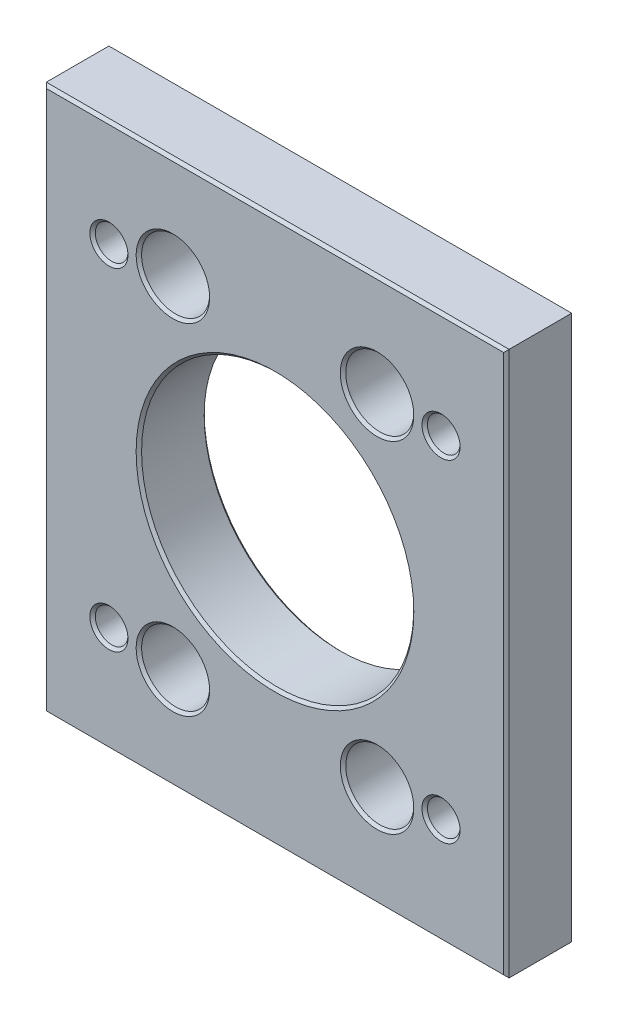
from build123d import *

# Parameters (mm, degrees)
SKETCH1_W           = 43.18
SKETCH1_H           = 50.8
SKETCH1_R           = 1.524
SKETCH1_R_2         = 3.175
SKETCH1_R_3         = 12.7
BOSS_EXTRUDE1_DEPTH = 6.35
CHAMFER1_SIZE       = 0.254


with BuildPart() as part:
    # Sketch1 → Boss-Extrude1 (new body)
    with BuildSketch(Plane.XY):
        Rectangle(SKETCH1_W, SKETCH1_H)
        with Locations((-15.494, 15.494)):
            Circle(SKETCH1_R, mode=Mode.SUBTRACT)
        with Locations((-9.525, 15.875)):
            Circle(SKETCH1_R_2, mode=Mode.SUBTRACT)
        with Locations((-15.494, -15.494)):
            Circle(SKETCH1_R, mode=Mode.SUBTRACT)
        with Locations((-9.525, -15.875)):
            Circle(SKETCH1_R_2, mode=Mode.SUBTRACT)
        with Locations((9.525, -15.875)):
            Circle(SKETCH1_R_2, mode=Mode.SUBTRACT)
        with Locations((15.494, -15.494)):
            Circle(SKETCH1_R, mode=Mode.SUBTRACT)
        with Locations((9.525, 15.875)):
            Circle(SKETCH1_R_2, mode=Mode.SUBTRACT)
        with Locations((15.494, 15.494)):
            Circle(SKETCH1_R, mode=Mode.SUBTRACT)
        Circle(SKETCH1_R_3, mode=Mode.SUBTRACT)
    extrude(amount=BOSS_EXTRUDE1_DEPTH)

    # Chamfer1
    chamfer1_edges = [part.edges().sort_by_distance(p)[0] for p in [
        (-21.59, 0, 6.35),
        (-17.018, 15.494, 0),
        (-17.018, 15.494, 6.35),
        (0, -25.4, 6.35),
        (-12.7, 15.875, 0),
        (-12.7, 15.875, 6.35),
        (-17.018, -15.494, 0),
        (-17.018, -15.494, 6.35),
        (-12.7, -15.875, 0),
        (-12.7, -15.875, 6.35),
        (6.35, -15.875, 0),
        (6.35, -15.875, 6.35),
        (13.97, -15.494, 0),
        (13.97, -15.494, 6.35),
        (6.35, 15.875, 0),
        (6.35, 15.875, 6.35),
        (13.97, 15.494, 0),
        (13.97, 15.494, 6.35),
        (21.59, 0, 6.35),
        (-12.7, 0, 0),
        (-12.7, 0, 6.35),
        (0, -25.4, 0),
        (-21.59, 0, 0),
        (0, 25.4, 0),
        (21.59, 0, 0),
        (0, 25.4, 6.35),
    ]]
    chamfer(chamfer1_edges, length=CHAMFER1_SIZE)


solid = part.part
